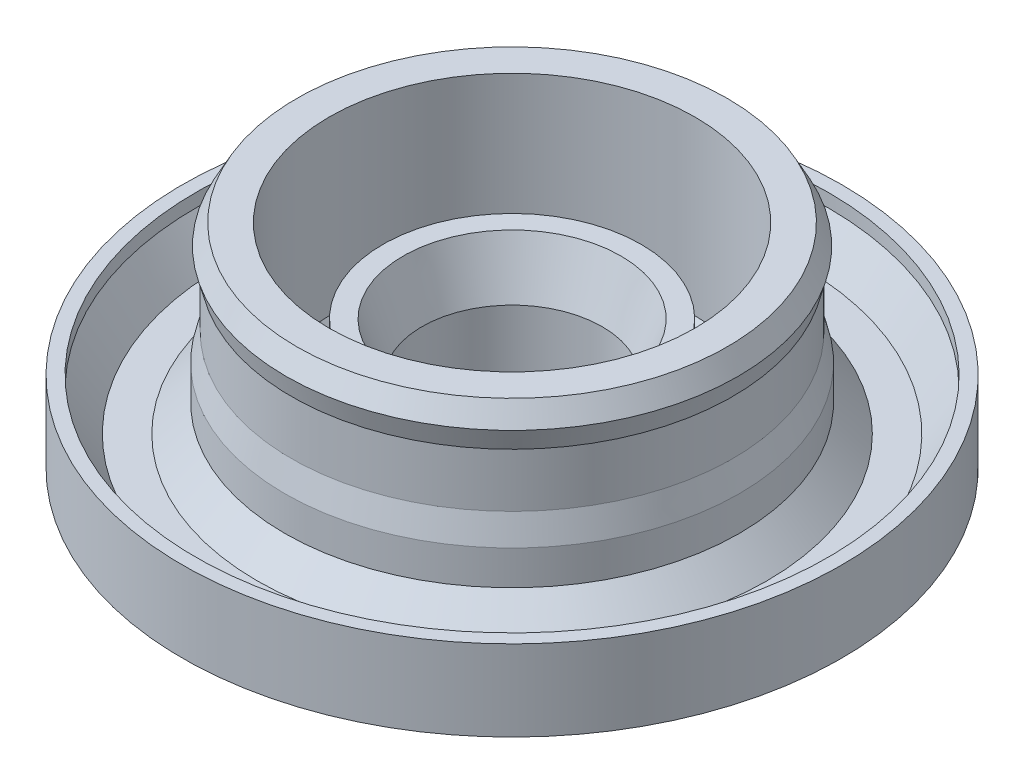
from build123d import *

# Parameters (mm, degrees)
SKETCH8_R           = 3.85
SKETCH8_R_2         = 3.35
BOSS_EXTRUDE1_DEPTH = 2.1
FILLET2_R           = 0.5
FILLET3_R           = 0.2


with BuildPart() as part:
    # Sketch1 → Revolve1 (revolve)
    with BuildSketch(Plane.XY, mode=Mode.PRIVATE) as revolve1_sk:
        Polygon((-12.25, 7.1), (-4.45, 7.1), (-4.45, 0), (-6, 0), (-6, 4.1), (-12.25, 4.1), align=None)
    revolve(revolve1_sk.sketch.rotate(Axis((0, 0, 0), (0, 1, 0)), 270), axis=Axis((0, 0, 0), (0, 1, 0)))

    # Sketch6 → Cut-Revolve2 (revolve, cut)
    with BuildSketch(Plane.XY, mode=Mode.PRIVATE) as cut_revolve2_sk:
        Polygon((-11.75, 7.1), (-11.75, 6.6), (-10.769709447, 5.2), (-6.8, 5.2), (-6.8, 4.5), (0, 4.5), (0, 7.1), (0, 9.850026385), (-11.75, 9.850026385), align=None)
    revolve(cut_revolve2_sk.sketch.rotate(Axis((0, 4.5, 0), (0, 1, 0)), 270), axis=Axis((0, 4.5, 0), (0, 1, 0)), mode=Mode.SUBTRACT)

    # Sketch7 → Revolve2 (revolve)
    with BuildSketch(Plane.XY, mode=Mode.PRIVATE) as revolve2_sk:
        Polygon((-4.8, 8.9), (-4.8, 3.744419371), (-3.35, 3.744419371), (-3.35, 6.976765806), (-4.05, 8.9), align=None)
    revolve(revolve2_sk.sketch.rotate(Axis((0, 0, 0), (0, 1, 0)), 270), axis=Axis((0, 0, 0), (0, 1, 0)))

    # Sketch8 → Boss-Extrude1 (add)
    with BuildSketch(Plane.XZ.offset(-3.744419371)):
        with Locations(Location((0, 0, 0), (0, 0, 90))):
            Circle(SKETCH8_R)
        with Locations(Location((0, 0, 0), (0, 0, 270))):
            Circle(SKETCH8_R_2, mode=Mode.SUBTRACT)
    extrude(amount=BOSS_EXTRUDE1_DEPTH)

    # Sketch9 → Revolve3 (revolve)
    with BuildSketch(Plane.XY, mode=Mode.PRIVATE) as revolve3_sk:
        Polygon((-6.799806645, 12), (-6.799806645, 5.2), (-9.469806645, 5.2), (-8.45, 6.219806645), (-8.45, 7.5), (-8.2, 8.5), (-8.2, 10.5), (-8.400961894, 11.25), (-7.999806645, 12), align=None)
    revolve(revolve3_sk.sketch.rotate(Axis((0, 0, 0), (0, 1, 0)), 270), axis=Axis((0, 0, 0), (0, 1, 0)))

    # Sketch11 → Revolve4 (revolve)
    with BuildSketch(Plane.XY, mode=Mode.PRIVATE) as revolve4_sk:
        Polygon((-6.799806645, 5.6), (-6, 4.5), (-6, 4.308890283), (-7.13977868, 4.308890283), (-7.13977868, 5.6), align=None)
    revolve(revolve4_sk.sketch.rotate(Axis((0, 0, 0), (0, 1, 0)), 270), axis=Axis((0, 0, 0), (0, 1, 0)))

    # Fillet2
    fillet2_edges = [part.edges().sort_by_distance(p)[0] for p in [
        (0, 0, 6),
    ]]
    fillet(fillet2_edges, radius=FILLET2_R)

    # Fillet3
    fillet3_edges = [part.edges().sort_by_distance(p)[0] for p in [
        (0, 1.644419371, -3.85),
    ]]
    fillet(fillet3_edges, radius=FILLET3_R)


solid = part.part
